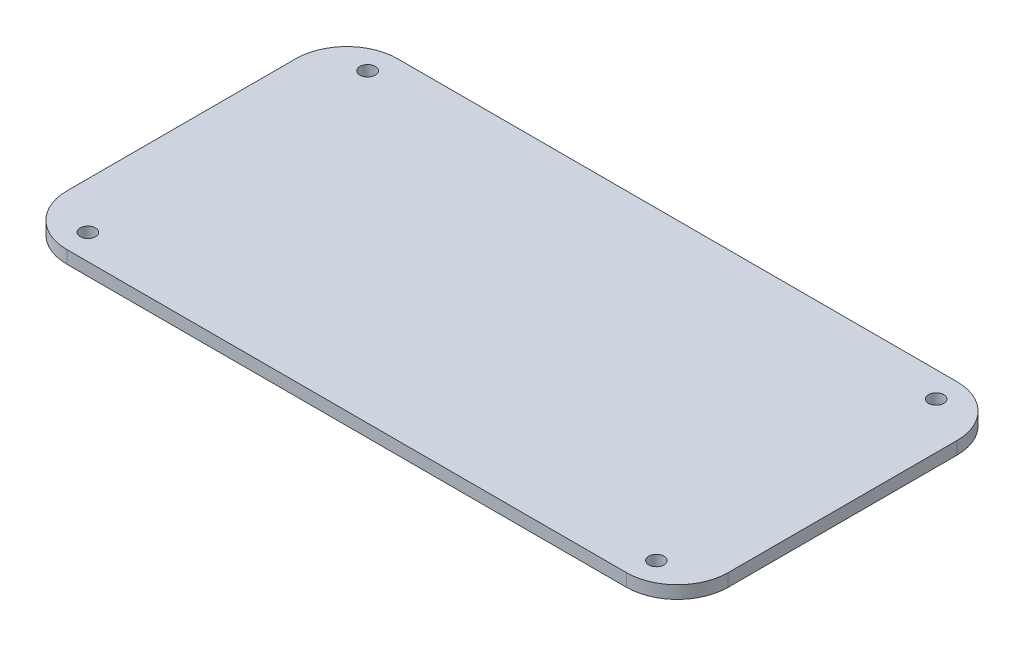
from build123d import *

# Parameters (mm, degrees)
BOSS_EXTRUDE1_DEPTH = 2.5
SKETCH2_R           = 1.5
CUT_EXTRUDE1_DEPTH  = 146.365917601


with BuildPart() as part:
    # Sketch1 → Boss-Extrude1 (new body)
    with BuildSketch(Plane(origin=(0, 0, 0), x_dir=(1, 0, 0), z_dir=(0, 1, 0))):
        with BuildLine():
            Line((10, 0), (120, 0))
            ThreePointArc((120, 0), (127.071067812, 2.928932188), (130, 10))
            Line((130, 10), (130, 55))
            ThreePointArc((130, 55), (127.071067812, 62.071067812), (120, 65))
            Line((120, 65), (10, 65))
            ThreePointArc((10, 65), (2.928932188, 62.071067812), (0, 55))
            Line((0, 55), (0, 10))
            ThreePointArc((0, 10), (2.928932188, 2.928932188), (10, 0))
        make_face()
    extrude(amount=BOSS_EXTRUDE1_DEPTH)

    # Sketch2 → Cut-Extrude1 (cut, through all)
    with BuildSketch(Plane(origin=(0, 2.5, 0), x_dir=(1, 0, 0), z_dir=(0, 1, 0))):
        with Locations(Location((9.112726, 5, 0), (0, 0, 270))):
            Circle(SKETCH2_R)
        with Locations(Location((9.112726, 60, 0), (0, 0, 270))):
            Circle(SKETCH2_R)
        with Locations(Location((120.887274, 5, 0), (0, 0, 90))):
            Circle(SKETCH2_R)
        with Locations(Location((120.887274, 60, 0), (0, 0, 90))):
            Circle(SKETCH2_R)
    extrude(amount=-CUT_EXTRUDE1_DEPTH, mode=Mode.SUBTRACT)


solid = part.part
